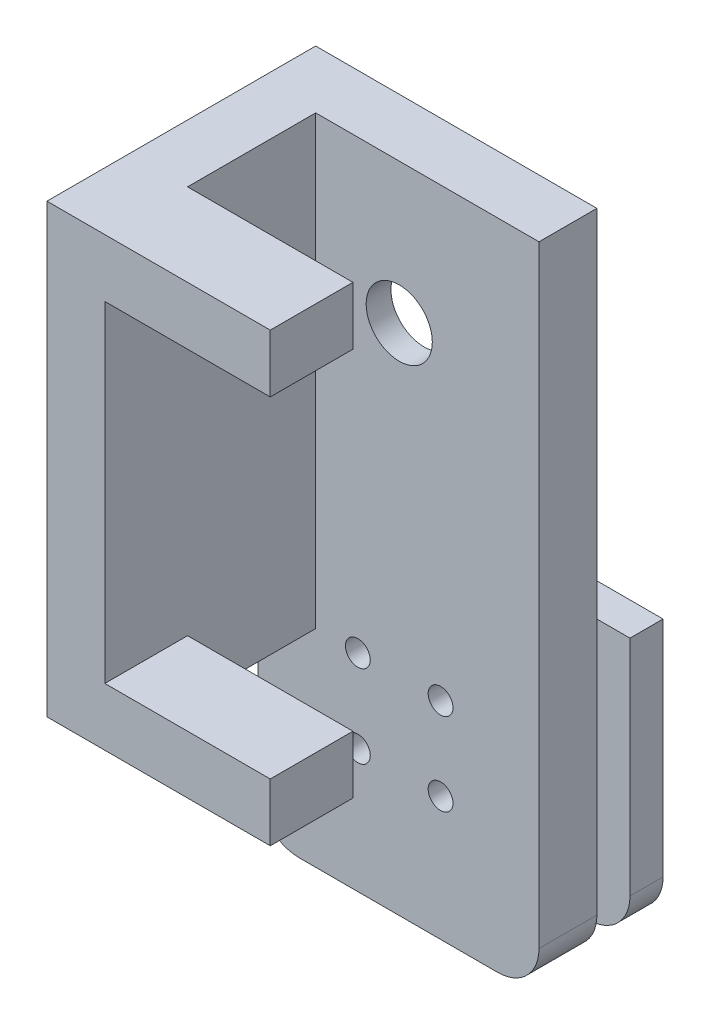
from build123d import *

# Parameters (mm, degrees)
BOSS_EXTRUDE1_DEPTH       = 10
SKETCH2_W                 = 7
SKETCH2_H                 = 54
BOSS_EXTRUDE2_DEPTH       = 15.494
SKETCH3_W                 = 7
SKETCH3_H                 = 54
BOSS_EXTRUDE3_DEPTH       = 34
SKETCH5_R                 = 11
CUT_EXTRUDE2_DEPTH        = 4
SKETCH6_R                 = 4
CUT_EXTRUDE3_DEPTH        = 10
SKETCH7_W                 = 34
SKETCH7_H                 = 7
BOSS_EXTRUDE4_DEPTH       = 25
BOSS_EXTRUDE5_DEPTH       = 32
F_3_0MM_DOWEL_HOLE1_D     = 3
F_3_0MM_DOWEL_HOLE1_DEPTH = 27
F_3_0MM_DOWEL_HOLE1_TIP   = 0.901290929
FILLET2_R                 = 5
FILLET3_R                 = 5


with BuildPart() as part:
    # Sketch1 → Boss-Extrude1 (new body)
    with BuildSketch(Plane.XY):
        Polygon((0, 0), (27, 0), (27, 7), (7, 7), (7, 47), (27, 47), (27, 54), (0, 54), align=None)
    extrude(amount=BOSS_EXTRUDE1_DEPTH)

    # Sketch2 → Boss-Extrude2 (add)
    with BuildSketch(Plane(origin=(0, 0, 0), x_dir=(-1, 0, 0), z_dir=(0, 0, -1))):
        with Locations((-3.5, 27)):
            Rectangle(SKETCH2_W, SKETCH2_H)
    extrude(amount=BOSS_EXTRUDE2_DEPTH)

    # Sketch3 → Boss-Extrude3 (add)
    with BuildSketch(Plane.ZY):
        with Locations((-18.994, 27)):
            Rectangle(SKETCH3_W, SKETCH3_H)
    extrude(amount=-BOSS_EXTRUDE3_DEPTH)

    # Sketch5 → Cut-Extrude2 (cut)
    with BuildSketch(Plane(origin=(0, 0, -22.494), x_dir=(-1, 0, 0), z_dir=(0, 0, -1))):
        with Locations(Location((-17.1, 37.04, 0), (0, 0, 90))):
            Circle(SKETCH5_R)
    extrude(amount=-CUT_EXTRUDE2_DEPTH, mode=Mode.SUBTRACT)

    # Sketch6 → Cut-Extrude3 (cut)
    with BuildSketch(Plane(origin=(0, 0, -18.494), x_dir=(-1, 0, 0), z_dir=(0, 0, -1))):
        with Locations(Location((-17.1, 37.04, 0), (0, 0, 90))):
            Circle(SKETCH6_R)
    extrude(amount=-CUT_EXTRUDE3_DEPTH, mode=Mode.SUBTRACT)

    # Sketch7 → Boss-Extrude4 (add)
    with BuildSketch(Plane.XZ):
        with Locations((17, -18.994)):
            Rectangle(SKETCH7_W, SKETCH7_H)
    extrude(amount=BOSS_EXTRUDE4_DEPTH)

    # Sketch8 → Boss-Extrude5 (add)
    with BuildSketch(Plane.XZ.offset(25)):
        Polygon((0, -22.494), (0, -30.494), (34, -30.494), (34, -26.494), (7, -26.494), (7, -22.494), align=None)
    extrude(amount=-BOSS_EXTRUDE5_DEPTH)

    # Ø3.0mm Dowel Hole1
    with Locations(Plane(origin=(0, 0, -30.494), x_dir=(-1, 0, 0), z_dir=(0, 0, -1))):
        with Locations((-22.1, -10), (-22.1, 0), (-12.1, 0), (-12.1, -10)):
            Hole(F_3_0MM_DOWEL_HOLE1_D / 2, depth=F_3_0MM_DOWEL_HOLE1_DEPTH)
            with Locations((0, 0, -(F_3_0MM_DOWEL_HOLE1_DEPTH + F_3_0MM_DOWEL_HOLE1_TIP / 2))):  # 118° drill point
                Cone(0, F_3_0MM_DOWEL_HOLE1_D / 2, F_3_0MM_DOWEL_HOLE1_TIP, mode=Mode.SUBTRACT)

    # Fillet2
    fillet2_edges = [part.edges().sort_by_distance(p)[0] for p in [
        (34, -25, -18.994),
        (34, -25, -28.494),
    ]]
    fillet(fillet2_edges, radius=FILLET2_R)

    # Fillet3
    fillet3_edges = [part.edges().sort_by_distance(p)[0] for p in [
        (0, -25, -22.994),
    ]]
    fillet(fillet3_edges, radius=FILLET3_R)


solid = part.part
